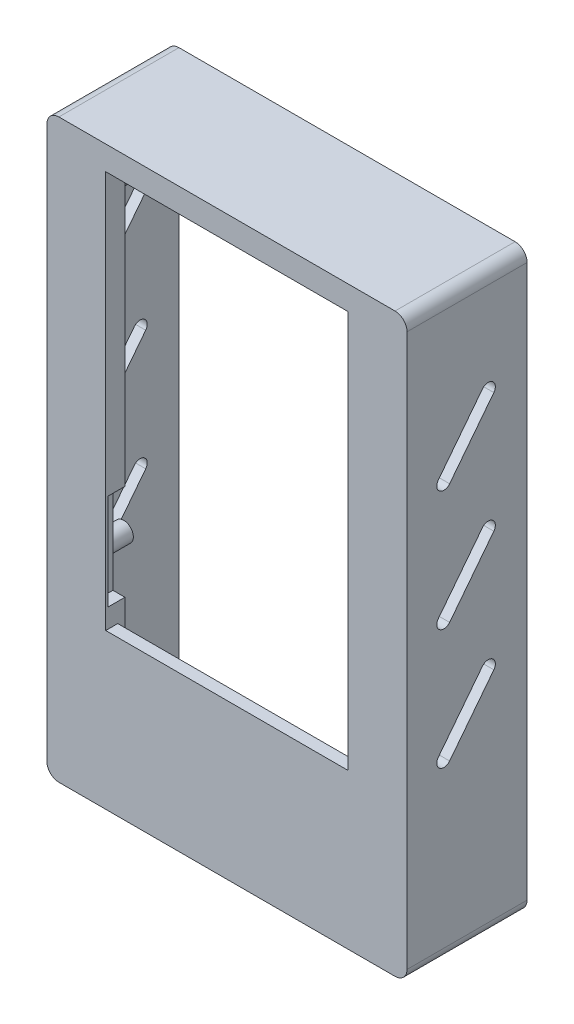
from build123d import *

# Parameters (mm, degrees)
ESQUISSE1_W              = 150
ESQUISSE1_H              = 240
BOSS_EXTRU_1_DEPTH       = 50
ENL_V_MAT_EXTRU_1_DEPTH  = 42
ESQUISSE3_W              = 101
ESQUISSE3_H              = 165.5
ENL_V_MAT_EXTRU_2_DEPTH  = 151.083310198
CONG_1_R                 = 5
ESQUISSE4_R              = 2.8
ENL_V_MAT_EXTRU_3_DEPTH  = 15
ENL_V_MAT_EXTRU_4_DEPTH  = 199.494332413
ESQUISSE7_R              = 2.3
ENL_V_MAT_EXTRU_5_DEPTH  = 5
ESQUISSE6_R              = 2
ENL_V_MAT_EXTRU_6_DEPTH  = 5
ESQUISSE8_W              = 5
ESQUISSE8_H              = 40
ENL_V_MAT_EXTRU_7_DEPTH  = 7
ESQUISSE9_R              = 4
BOSS_EXTRU_2_DEPTH       = 9
ESQUISSE10_R             = 2.3
ENL_V_MAT_EXTRU_8_DEPTH  = 8
ESQUISSE11_W             = 101
ESQUISSE11_H             = 11
ENL_V_MAT_EXTRU_9_DEPTH  = 3
BOSS_EXTRU_3_START       = 10
ESQUISSE13_R             = 4
ESQUISSE13_R_2           = 2.3
ESQUISSE13_R_3           = 2
BOSS_EXTRU_3_DEPTH       = 10
ESQUISSE14_R             = 2.3
ENL_V_MAT_EXTRU_10_DEPTH = 6.7


with BuildPart() as part:
    # Esquisse1 → Boss.-Extru.1 (new body)
    with BuildSketch(Plane.XY):
        Rectangle(ESQUISSE1_W, ESQUISSE1_H)
    extrude(amount=BOSS_EXTRU_1_DEPTH)

    # Esquisse2 → Enlèv. mat.-Extru.1 (cut)
    with BuildSketch(Plane(origin=(0, 0, 0), x_dir=(-1, 0, 0), z_dir=(0, 0, -1))):
        with BuildLine():
            Line((-70, -110), (-70, 110))
            Line((-70, 110), (-67, 110))
            ThreePointArc((-67, 110), (-65.585786438, 110.585786438), (-65, 112))
            Line((-65, 112), (-65, 115))
            Line((-65, 115), (65, 115))
            Line((65, 115), (65, 112))
            ThreePointArc((65, 112), (65.585786438, 110.585786438), (67, 110))
            Line((67, 110), (70, 110))
            Line((70, 110), (70, -110))
            Line((70, -110), (26, -110))
            ThreePointArc((26, -110), (25.292893219, -110.292893219), (25, -111))
            Line((25, -111), (25, -115))
            Line((25, -115), (-65, -115))
            Line((-65, -115), (-65, -112))
            ThreePointArc((-65, -112), (-65.585786438, -110.585786438), (-67, -110))
            Line((-67, -110), (-70, -110))
        make_face()
    extrude(amount=-ENL_V_MAT_EXTRU_1_DEPTH, mode=Mode.SUBTRACT)

    # Esquisse3 → Enlèv. mat.-Extru.2 (cut, through all)
    with BuildSketch(Plane.XY.offset(50)):
        with Locations((0, 27.25)):
            Rectangle(ESQUISSE3_W, ESQUISSE3_H)
    extrude(amount=-ENL_V_MAT_EXTRU_2_DEPTH, mode=Mode.SUBTRACT)

    # Congé1
    cong_1_edges = [part.edges().sort_by_distance(p)[0] for p in [
        (75, -120, 25),
        (-75, -120, 25),
        (-75, 120, 25),
        (75, 120, 25),
    ]]
    fillet(cong_1_edges, radius=CONG_1_R)

    # Esquisse4 → Enlèv. mat.-Extru.3 (cut)
    with BuildSketch(Plane(origin=(0, 0, 0), x_dir=(-1, 0, 0), z_dir=(0, 0, -1))):
        with Locations((-70, 115)):
            Circle(ESQUISSE4_R)
        with Locations((70, 115)):
            Circle(ESQUISSE4_R)
        with Locations((70, -115)):
            Circle(ESQUISSE4_R)
        with Locations((-70, -115)):
            Circle(ESQUISSE4_R)
    extrude(amount=-ENL_V_MAT_EXTRU_3_DEPTH, mode=Mode.SUBTRACT)

    # Esquisse5 → Enlèv. mat.-Extru.4 (cut, through all)
    with BuildSketch(Plane(origin=(75, 0, 0), x_dir=(0, 0, -1), z_dir=(1, 0, 0))):
        with BuildLine():
            Line((-37, 55), (-18.584929033, 78.683014193))
            ThreePointArc((-18.584929033, 78.683014193), (-14.375120517, 79.209808516), (-13.848326194, 75))
            Line((-13.848326194, 75), (-32.263397161, 51.316985807))
            ThreePointArc((-32.263397161, 51.316985807), (-36.473205677, 50.790191484), (-37, 55))
        make_face()
        with BuildLine():
            Line((-37, 5), (-18.584929033, 28.683014193))
            ThreePointArc((-18.584929033, 28.683014193), (-14.375120517, 29.209808516), (-13.848326194, 25))
            Line((-13.848326194, 25), (-32.263397161, 1.316985807))
            ThreePointArc((-32.263397161, 1.316985807), (-36.473205677, 0.790191484), (-37, 5))
        make_face()
        with BuildLine():
            Line((-37, -45), (-18.584929033, -21.316985807))
            ThreePointArc((-18.584929033, -21.316985807), (-14.375120517, -20.790191484), (-13.848326194, -25))
            Line((-13.848326194, -25), (-32.263397161, -48.683014193))
            ThreePointArc((-32.263397161, -48.683014193), (-36.473205677, -49.209808516), (-37, -45))
        make_face()
    extrude(amount=-ENL_V_MAT_EXTRU_4_DEPTH, mode=Mode.SUBTRACT)

    # Esquisse7 → Enlèv. mat.-Extru.5 (cut)
    with BuildSketch(Plane(origin=(0, 0, 42), x_dir=(-1, 0, 0), z_dir=(0, 0, -1))):
        with Locations((-57, 105.8)):
            Circle(ESQUISSE7_R)
        with Locations((-57, -51.3)):
            Circle(ESQUISSE7_R)
        with Locations((57, 105.8)):
            Circle(ESQUISSE7_R)
        with Locations((57, -51.3)):
            Circle(ESQUISSE7_R)
    extrude(amount=-ENL_V_MAT_EXTRU_5_DEPTH, mode=Mode.SUBTRACT)

    # Esquisse6 → Enlèv. mat.-Extru.6 (cut)
    with BuildSketch(Plane(origin=(0, 0, 42), x_dir=(-1, 0, 0), z_dir=(0, 0, -1))):
        with Locations((-14.8, -79.815913119)):
            Circle(ESQUISSE6_R)
        with Locations((13, -105.015913119)):
            Circle(ESQUISSE6_R)
    extrude(amount=-ENL_V_MAT_EXTRU_6_DEPTH, mode=Mode.SUBTRACT)

    # Esquisse8 → Enlèv. mat.-Extru.7 (cut)
    with BuildSketch(Plane(origin=(0, 0, 42), x_dir=(-1, 0, 0), z_dir=(0, 0, -1))):
        with Locations((53, -27.5)):
            Rectangle(ESQUISSE8_W, ESQUISSE8_H)
    extrude(amount=-ENL_V_MAT_EXTRU_7_DEPTH, mode=Mode.SUBTRACT)

    # Esquisse9 → Boss.-Extru.2 (add)
    with BuildSketch(Plane(origin=(0, 0, 42), x_dir=(-1, 0, 0), z_dir=(0, 0, -1))):
        with Locations((-60, 97)):
            Circle(ESQUISSE9_R)
        with Locations((60, 97)):
            Circle(ESQUISSE9_R)
        with Locations((60, -33)):
            Circle(ESQUISSE9_R)
        with Locations((-60, -33)):
            Circle(ESQUISSE9_R)
    extrude(amount=BOSS_EXTRU_2_DEPTH)

    # Esquisse10 → Enlèv. mat.-Extru.8 (cut)
    with BuildSketch(Plane(origin=(0, 0, 33), x_dir=(-1, 0, 0), z_dir=(0, 0, -1))):
        with Locations((-60, 97)):
            Circle(ESQUISSE10_R)
        with Locations((60, 97)):
            Circle(ESQUISSE10_R)
        with Locations((60, -33)):
            Circle(ESQUISSE10_R)
        with Locations((-60, -33)):
            Circle(ESQUISSE10_R)
    extrude(amount=-ENL_V_MAT_EXTRU_8_DEPTH, mode=Mode.SUBTRACT)

    # Esquisse11 → Enlèv. mat.-Extru.9 (cut)
    with BuildSketch(Plane(origin=(0, 0, 42), x_dir=(-1, 0, 0), z_dir=(0, 0, -1))):
        with Locations((0, -61)):
            Rectangle(ESQUISSE11_W, ESQUISSE11_H)
    extrude(amount=-ENL_V_MAT_EXTRU_9_DEPTH, mode=Mode.SUBTRACT)

    # Esquisse13 → Boss.-Extru.3 (add)
    # profile 1 of 2: a face of its own
    with BuildSketch(Plane(origin=(0, 0, 42), x_dir=(-1, 0, 0), z_dir=(0, 0, -1)).offset(BOSS_EXTRU_3_START)):
        with Locations((-14.8, -79.815913119)):
            Circle(ESQUISSE13_R)
        with Locations((-14.8, -79.815913119)):
            Circle(ESQUISSE13_R_2, mode=Mode.SUBTRACT)
    # profile 2 of 2: a face of its own
    with BuildSketch(Plane(origin=(0, 0, 42), x_dir=(-1, 0, 0), z_dir=(0, 0, -1)).offset(BOSS_EXTRU_3_START)):
        with Locations((13, -105.015913119)):
            Circle(ESQUISSE13_R)
        with Locations((13, -105.015913119)):
            Circle(ESQUISSE13_R_3, mode=Mode.SUBTRACT)
    extrude(amount=-BOSS_EXTRU_3_DEPTH)

    # Esquisse14 → Enlèv. mat.-Extru.10 (cut)
    with BuildSketch(Plane(origin=(0, -110, 0), x_dir=(1, 0, 0), z_dir=(0, 1, 0))):
        with Locations((-63.627600244, -37.7)):
            Circle(ESQUISSE14_R)
        with Locations((-63.627600244, -4.8)):
            Circle(ESQUISSE14_R)
        with Locations((-20.327600244, -4.8)):
            Circle(ESQUISSE14_R)
    extrude(amount=-ENL_V_MAT_EXTRU_10_DEPTH, mode=Mode.SUBTRACT)


solid = part.part
